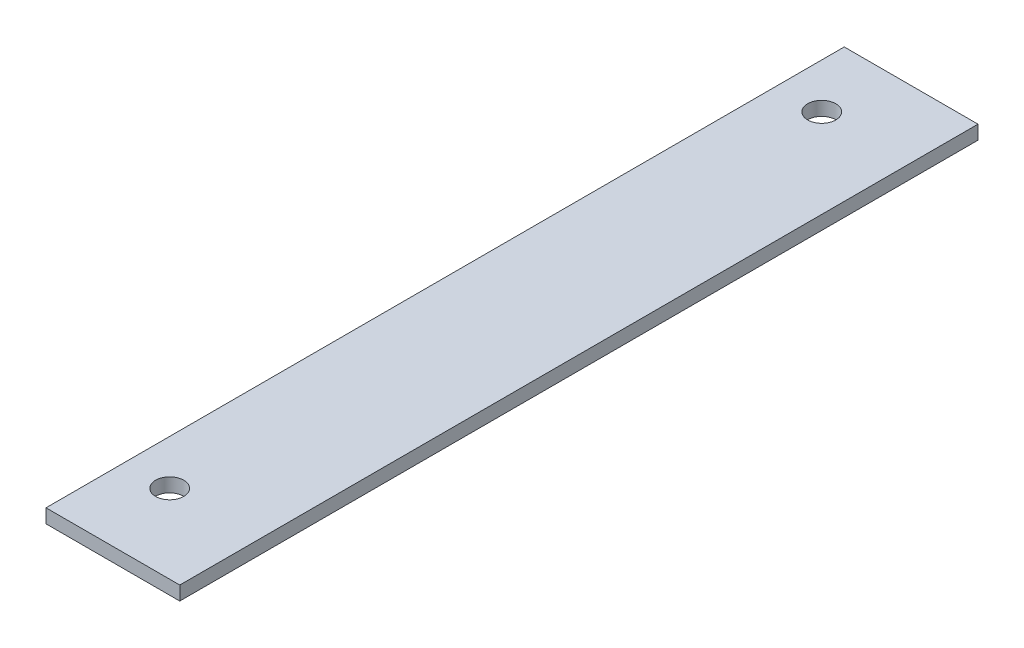
from build123d import *

# Parameters (mm, degrees)
SKETCH1_W           = 15.11
SKETCH1_H           = 90.17
BOSS_EXTRUDE1_DEPTH = 1.57
SKETCH2_R           = 1.59
CUT_EXTRUDE1_DEPTH  = 46.740574439


with BuildPart() as part:
    # Sketch1 → Boss-Extrude1 (new body)
    with BuildSketch(Plane(origin=(0, 0, 0), x_dir=(1, 0, 0), z_dir=(0, 1, 0))):
        Rectangle(SKETCH1_W, SKETCH1_H)
    extrude(amount=BOSS_EXTRUDE1_DEPTH)

    # Sketch2 → Cut-Extrude1 (cut, through all)
    with BuildSketch(Plane(origin=(0, 1.57, 0), x_dir=(1, 0, 0), z_dir=(0, 1, 0))):
        with Locations(Location((-2.475, -36.195, 0), (0, 0, 270))):
            Circle(SKETCH2_R)
        with Locations(Location((-2.475, 37.465, 0), (0, 0, 270))):
            Circle(SKETCH2_R)
    extrude(amount=-CUT_EXTRUDE1_DEPTH, mode=Mode.SUBTRACT)


solid = part.part
